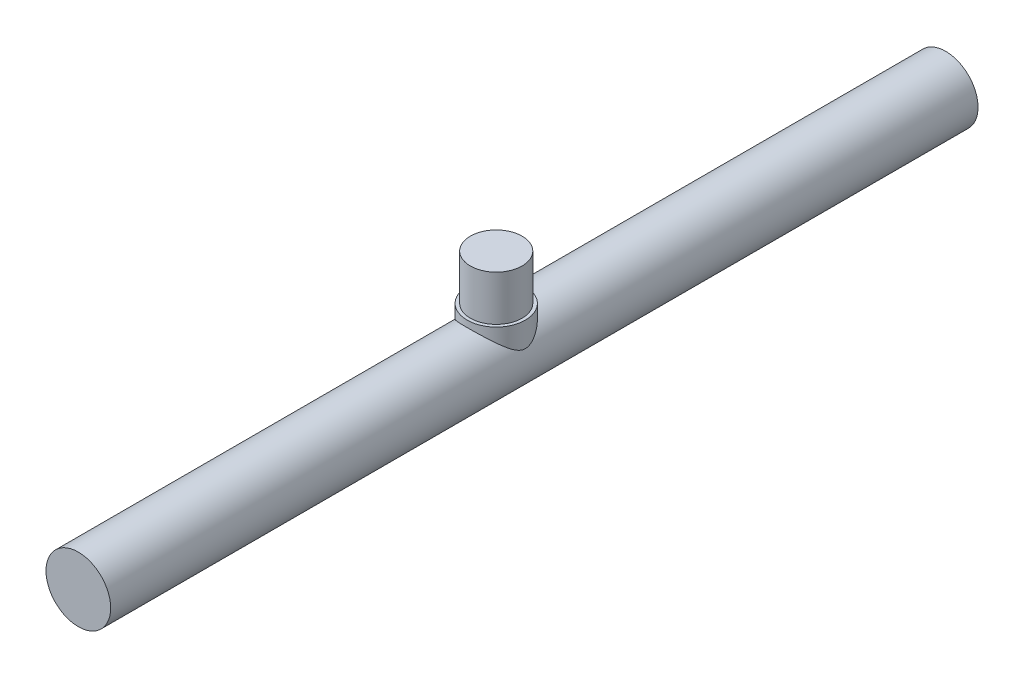
from build123d import *

# Parameters (mm, degrees)
SKETCH1_R           = 5
BOSS_EXTRUDE1_DEPTH = 70
SKETCH2_R           = 4.5
BOSS_EXTRUDE2_DEPTH = 6
SKETCH3_R           = 5
CUT_EXTRUDE2_DEPTH  = 0.88667719
SKETCH4_R           = 4
BOSS_EXTRUDE3_DEPTH = 7
BOSS_EXTRUDE4_START = 65
SKETCH5_R           = 5
BOSS_EXTRUDE4_DEPTH = 65


with BuildPart() as part:
    # Sketch1 → Boss-Extrude1 (new body)
    with BuildSketch(Plane.XY):
        Circle(SKETCH1_R)
    extrude(amount=BOSS_EXTRUDE1_DEPTH)

    # Sketch2 → Boss-Extrude2 (add)
    with BuildSketch(Plane(origin=(0, 0, 0), x_dir=(1, 0, 0), z_dir=(0, 1, 0))):
        with Locations(Location((0, -5.386677191, 0), (0, 0, 90))):
            Circle(SKETCH2_R)
    extrude(amount=BOSS_EXTRUDE2_DEPTH)

    # Sketch3 → Cut-Extrude2 (cut)
    with BuildSketch(Plane(origin=(0, 0, 0), x_dir=(-1, 0, 0), z_dir=(0, 0, -1))):
        with Locations(Location((0, 0, 0), (0, 0, 90))):
            Circle(SKETCH3_R)
    extrude(amount=-CUT_EXTRUDE2_DEPTH, mode=Mode.SUBTRACT)

    # Sketch4 → Boss-Extrude3 (add)
    with BuildSketch(Plane(origin=(0, 6, 0), x_dir=(1, 0, 0), z_dir=(0, 1, 0))):
        with Locations(Location((0, -5.386677191, 0), (0, 0, 270))):
            Circle(SKETCH4_R)
    extrude(amount=BOSS_EXTRUDE3_DEPTH)

    # Sketch5 → Boss-Extrude4 (add)
    with BuildSketch(Plane(origin=(0, 0, 0.88667719), x_dir=(-1, 0, 0), z_dir=(0, 0, -1)).offset(BOSS_EXTRUDE4_START)):
        Circle(SKETCH5_R)
    extrude(amount=-BOSS_EXTRUDE4_DEPTH)


solid = part.part
